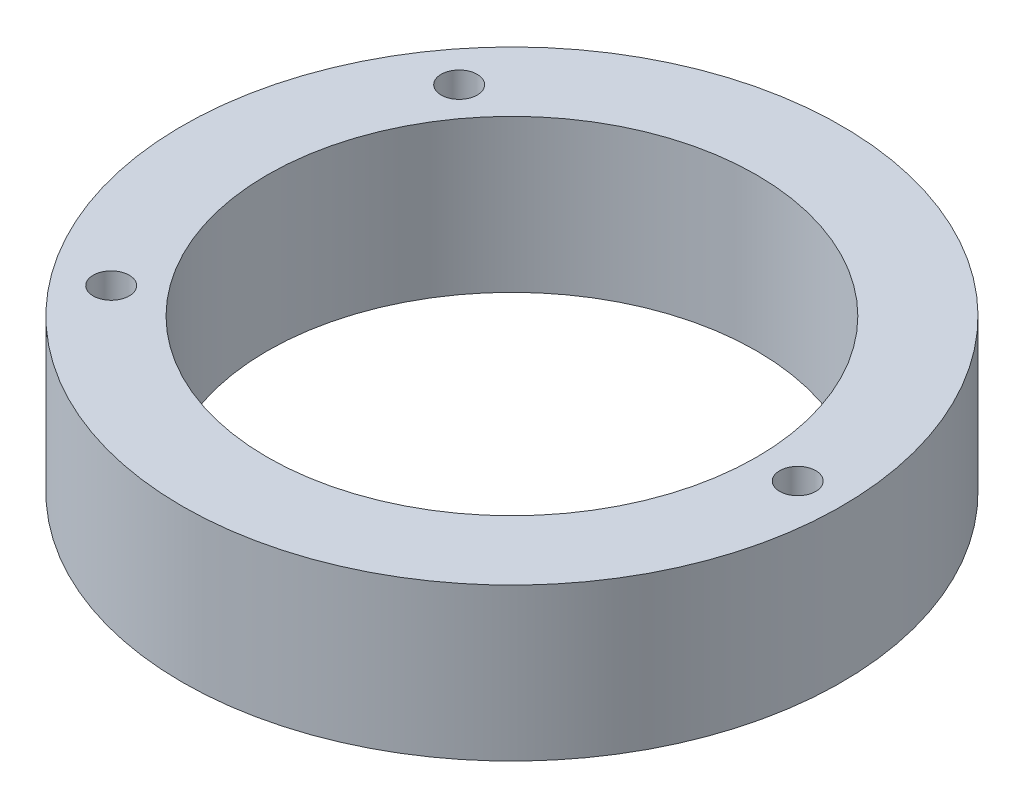
from build123d import *

# Parameters (mm, degrees)
SKETCH1_R           = 32
SKETCH1_R_2         = 23.75
SKETCH1_R_3         = 1.75
BOSS_EXTRUDE1_DEPTH = 14.8


with BuildPart() as part:
    # Sketch1 → Boss-Extrude1 (new body)
    with BuildSketch(Plane(origin=(0, 0, 0), x_dir=(1, 0, 0), z_dir=(0, 1, 0))):
        with Locations(Location((0, 0, 0), (0, 0, 270))):
            Circle(SKETCH1_R)
        with Locations(Location((0, 0, 0), (0, 0, 270))):
            Circle(SKETCH1_R_2, mode=Mode.SUBTRACT)
        with Locations(Location((27.75, 0, 0), (0, 0, 270))):
            Circle(SKETCH1_R_3, mode=Mode.SUBTRACT)
        with Locations(Location((-22.015555193, -16.893129655, 0), (0, 0, 270))):
            Circle(SKETCH1_R_3, mode=Mode.SUBTRACT)
        with Locations(Location((-22.015555193, 16.893129655, 0), (0, 0, 270))):
            Circle(SKETCH1_R_3, mode=Mode.SUBTRACT)
    extrude(amount=BOSS_EXTRUDE1_DEPTH)


solid = part.part
